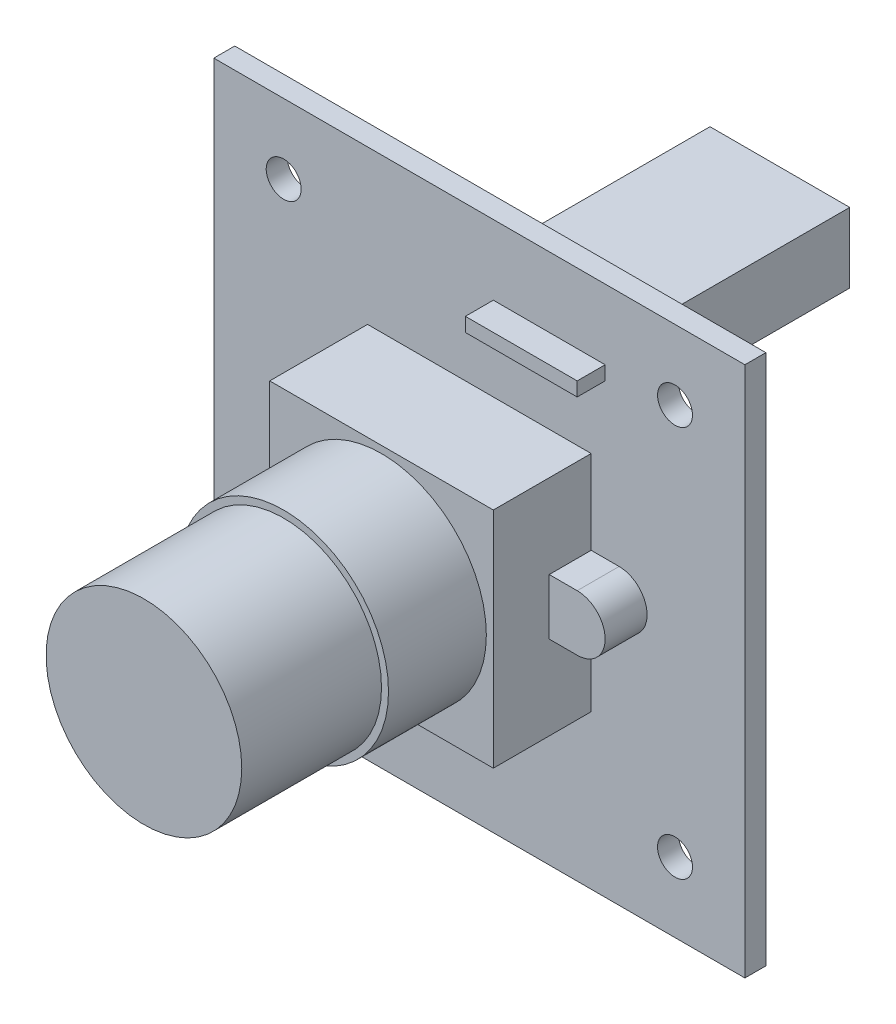
from build123d import *

# Parameters (mm, degrees)
SKETCH_1_W      = 38
SKETCH_1_H      = 38
SKETCH_1_R      = 1.25
EXTRUDE_1_DEPTH = 1.5
SKETCH_2_W      = 16
SKETCH_2_H      = 16
EXTRUDE_2_DEPTH = 7
SKETCH_3_R      = 7.5
EXTRUDE_3_DEPTH = 7
EXTRUDE_4_DEPTH = 3
SKETCH_6_W      = 10
SKETCH_6_H      = 5
EXTRUDE_5_DEPTH = 15
SKETCH_7_R      = 7
EXTRUDE_6_DEPTH = 10
SKETCH_8_W      = 8
SKETCH_8_H      = 1
EXTRUDE_7_DEPTH = 2


with BuildPart() as part:
    # 草图1 → 凸台-拉伸1 (new body)
    with BuildSketch(Plane.XY):
        Rectangle(SKETCH_1_W, SKETCH_1_H)
        with Locations((-14, 14)):
            Circle(SKETCH_1_R, mode=Mode.SUBTRACT)
        with Locations((14, 14)):
            Circle(SKETCH_1_R, mode=Mode.SUBTRACT)
        with Locations((14, -14)):
            Circle(SKETCH_1_R, mode=Mode.SUBTRACT)
        with Locations((-14, -14)):
            Circle(SKETCH_1_R, mode=Mode.SUBTRACT)
    extrude(amount=EXTRUDE_1_DEPTH)

    # 草图2 → 凸台-拉伸2 (add)
    with BuildSketch(Plane.XY.offset(1.5)):
        Rectangle(SKETCH_2_W, SKETCH_2_H)
    extrude(amount=EXTRUDE_2_DEPTH)

    # 草图3 → 凸台-拉伸3 (add)
    with BuildSketch(Plane.XY.offset(8.5)):
        Circle(SKETCH_3_R)
    extrude(amount=EXTRUDE_3_DEPTH)

    # 草图5 → 凸台-拉伸4 (add)
    with BuildSketch(Plane.XY.offset(1.5)):
        with BuildLine():
            Line((10, -2), (-10, -2))
            ThreePointArc((-10, -2), (-12, 0), (-10, 2))
            Line((-10, 2), (10, 2))
            ThreePointArc((10, 2), (12, 0), (10, -2))
        make_face()
    extrude(amount=EXTRUDE_4_DEPTH)

    # 草图6 → 凸台-拉伸5 (add)
    with BuildSketch(Plane(origin=(0, 0, 0), x_dir=(-1, 0, 0), z_dir=(0, 0, -1))):
        with Locations((-5, 13.5)):
            Rectangle(SKETCH_6_W, SKETCH_6_H)
    extrude(amount=EXTRUDE_5_DEPTH)

    # 草图7 → 凸台-拉伸6 (add)
    with BuildSketch(Plane.XY.offset(15.5)):
        Circle(SKETCH_7_R)
    extrude(amount=EXTRUDE_6_DEPTH)

    # 草图8 → 凸台-拉伸7 (add)
    with BuildSketch(Plane.XY.offset(1.5)):
        with Locations((5, 13.5)):
            Rectangle(SKETCH_8_W, SKETCH_8_H)
    extrude(amount=EXTRUDE_7_DEPTH)


solid = part.part
